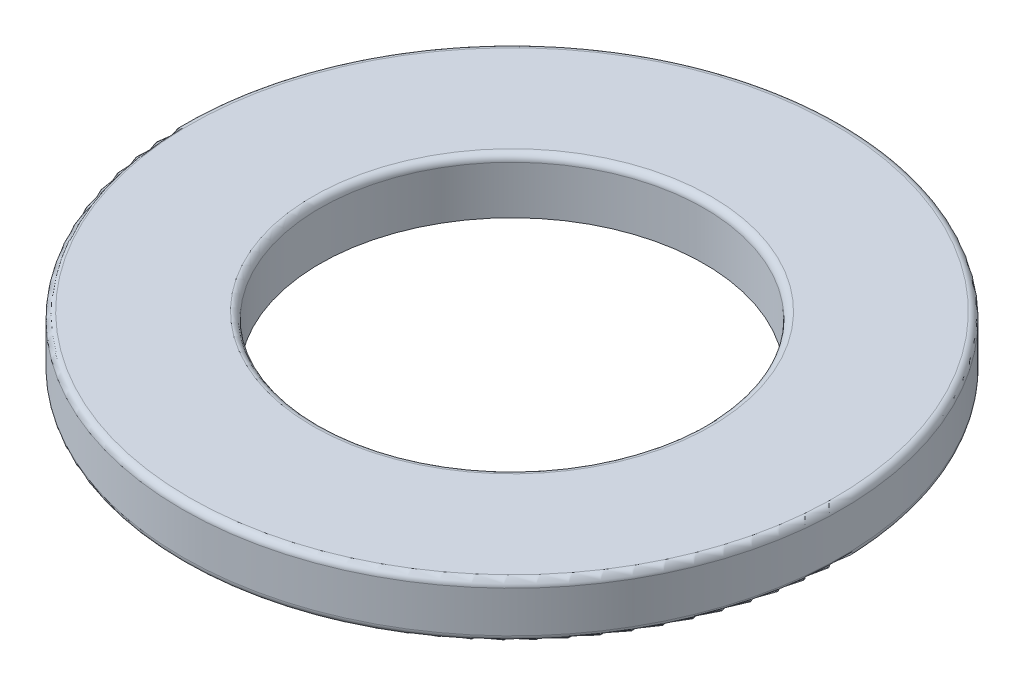
from build123d import *

# Parameters (mm, degrees)
SKETCH1_R           = 12
BOSS_EXTRUDE1_DEPTH = 2
SKETCH2_R           = 7
CUT_EXTRUDE1_DEPTH  = 18.088007491
FILLET1_R           = 0.25


with BuildPart() as part:
    # Sketch1 → Boss-Extrude1 (new body)
    with BuildSketch(Plane(origin=(0, 0, 0), x_dir=(1, 0, 0), z_dir=(0, 1, 0))):
        with Locations(Location((0, 0, 0), (0, 0, 270))):
            Circle(SKETCH1_R)
    extrude(amount=BOSS_EXTRUDE1_DEPTH)

    # Sketch2 → Cut-Extrude1 (cut, through all)
    with BuildSketch(Plane(origin=(0, 2, 0), x_dir=(1, 0, 0), z_dir=(0, 1, 0))):
        with Locations(Location((0, 0, 0), (0, 0, 270))):
            Circle(SKETCH2_R)
    extrude(amount=-CUT_EXTRUDE1_DEPTH, mode=Mode.SUBTRACT)

    # Fillet1
    fillet1_edges = [part.edges().sort_by_distance(p)[0] for p in [
        (0, 0, -12),
        (0, 2, -12),
        (0, 2, -7),
    ]]
    fillet(fillet1_edges, radius=FILLET1_R)


solid = part.part
